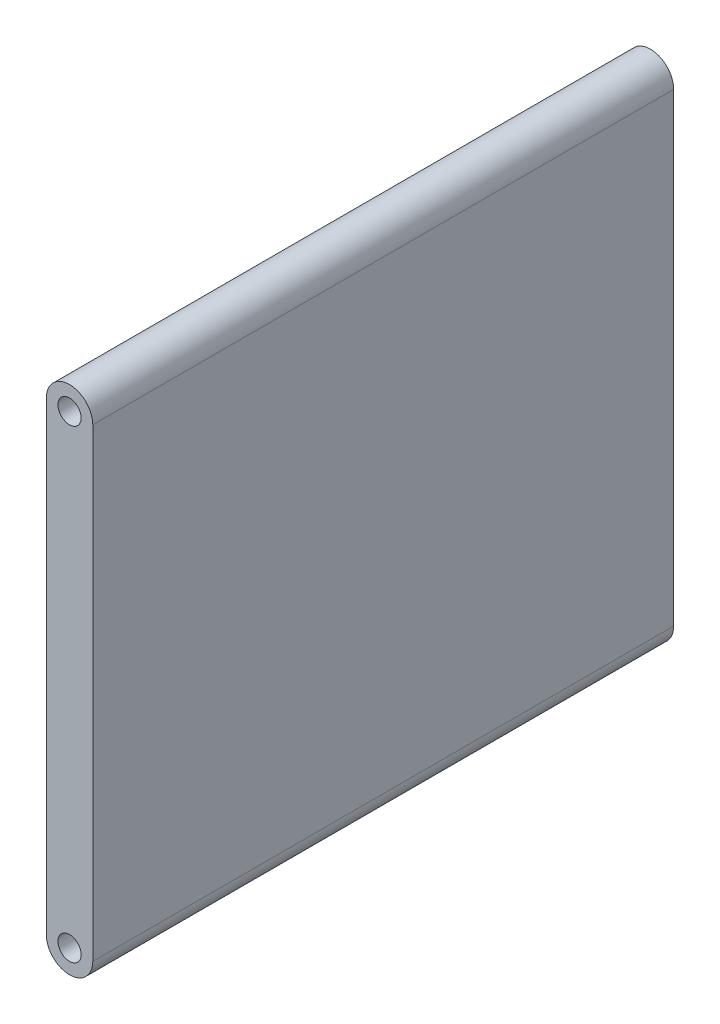
from build123d import *

# Parameters (mm, degrees)
CROQUIS1_R              = 1.4
SALIENTE_EXTRUIR1_DEPTH = 70


with BuildPart() as part:
    # Croquis1 → Saliente-Extruir1 (new body)
    with BuildSketch(Plane.XY):
        with BuildLine():
            Line((2.8, -28), (2.8, 28))
            ThreePointArc((2.8, 28), (0, 30.8), (-2.8, 28))
            Line((-2.8, 28), (-2.8, -28))
            ThreePointArc((-2.8, -28), (0, -30.8), (2.8, -28))
        make_face()
        with Locations((0, 28)):
            Circle(CROQUIS1_R, mode=Mode.SUBTRACT)
        with Locations((0, -28)):
            Circle(CROQUIS1_R, mode=Mode.SUBTRACT)
    extrude(amount=SALIENTE_EXTRUIR1_DEPTH)


solid = part.part
